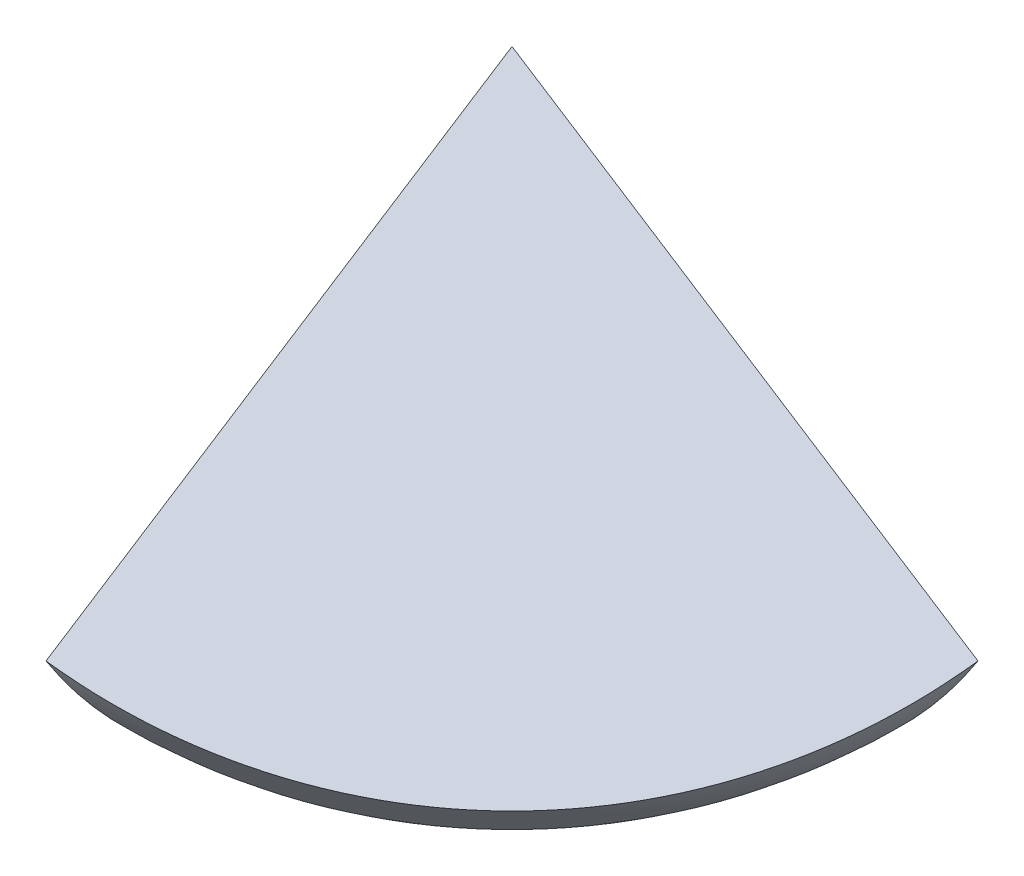
from build123d import *

# Parameters (mm, degrees)
REVOLVE_2_ANGLE     = 90
CUT_EXTRUDE_2_DEPTH = 234.165859049


with BuildPart() as part:
    # 草图1 → 旋转2 (revolve)
    with BuildSketch(Plane.XY):
        with BuildLine():
            Line((0, 0), (0, -150))
            ThreePointArc((0, -150), (71.918679038, -131.634735558), (126.226617292, -81.036048072))
            Line((126.226617292, -81.036048072), (0, 0))
        make_face()
    revolve(axis=Axis((0, 0, 0), (0, -1, 0)), revolution_arc=REVOLVE_2_ANGLE)

    # 草图3 → 切除-拉伸2 (cut, through all)
    with BuildSketch(Plane(origin=(0, 0, 0), x_dir=(-0.8798169831257074, 0.39998068520537344, 0.2567830361729893), z_dir=(-0.4753126089255142, -0.7403754774388752, -0.4753126089255143))):
        with BuildLine():
            Line((0, -150), (0, 0))
            Line((0, 0), (-143.46917565, -43.77894058))
            ThreePointArc((-143.46917565, -43.77894058), (-89.255697053, -120.554637171), (0, -150))
        make_face()
    extrude(amount=-CUT_EXTRUDE_2_DEPTH, mode=Mode.SUBTRACT)


solid = part.part
